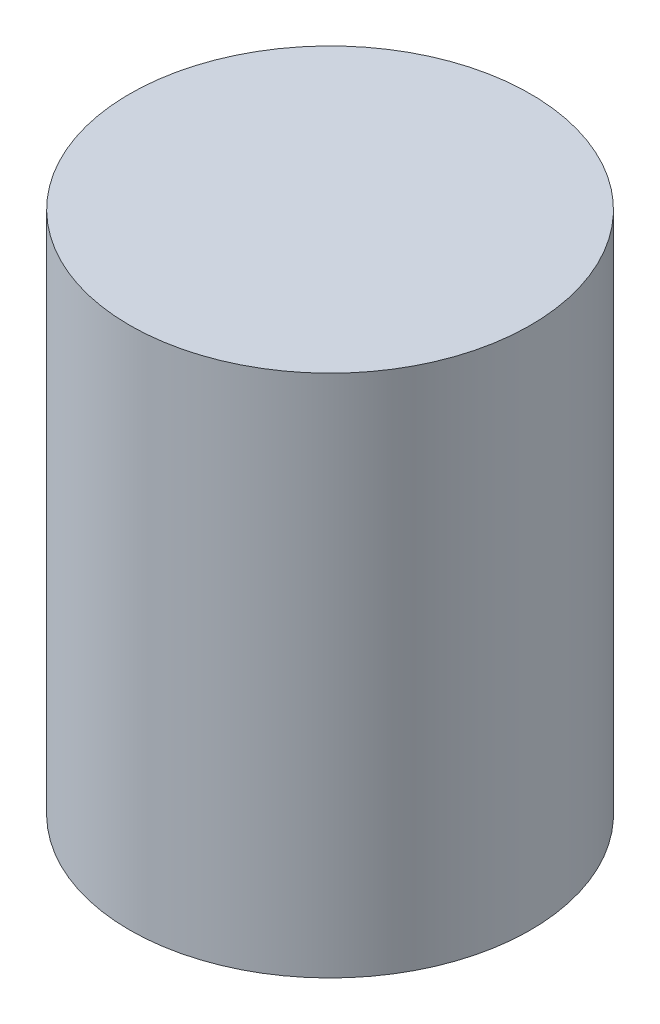
from build123d import *

# Parameters (mm, degrees)
SKETCH1_R          = 19.05
EXTRUDE1_DEPTH     = 49.784
SKETCH2_R          = 17.399
CUT_EXTRUDE2_DEPTH = 48.133


with BuildPart() as part:
    # Sketch1 → Extrude1 (new body)
    with BuildSketch(Plane(origin=(0, 0, 0), x_dir=(1, 0, 0), z_dir=(0, 1, 0))):
        with Locations(Location((0, 0, 0), (0, 0, 270))):
            Circle(SKETCH1_R)
    extrude(amount=EXTRUDE1_DEPTH)

    # Sketch2 → Cut-Extrude2 (cut)
    with BuildSketch(Plane(origin=(0, 0, 0), x_dir=(1, 0, 0), z_dir=(0, 1, 0))):
        with Locations(Location((0, 0, 0), (0, 0, 270))):
            Circle(SKETCH2_R)
    extrude(amount=CUT_EXTRUDE2_DEPTH, mode=Mode.SUBTRACT)


solid = part.part
